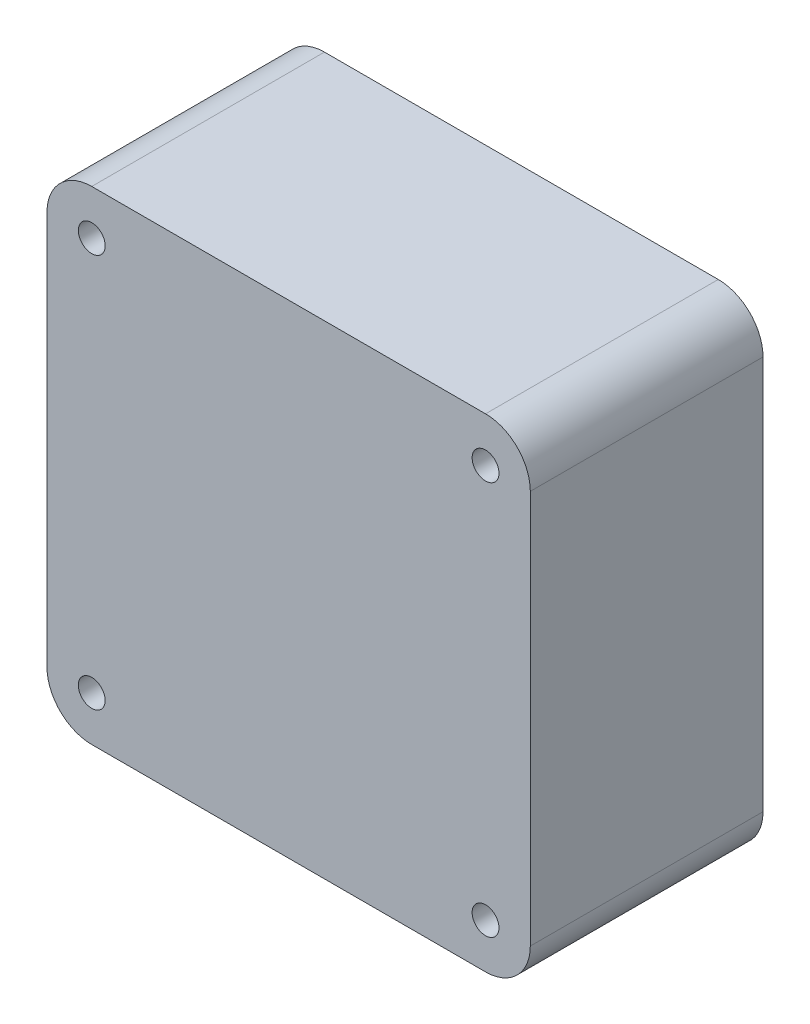
from build123d import *

# Parameters (mm, degrees)
CROQUIS1_W              = 54
CROQUIS1_H              = 54
SALIENTE_EXTRUIR1_DEPTH = 26
REDONDEO1_R             = 5
CROQUIS2_R              = 1.5
CORTAR_EXTRUIR1_DEPTH   = 47.19523785


with BuildPart() as part:
    # Croquis1 → Saliente-Extruir1 (new body)
    with BuildSketch(Plane.XY):
        Rectangle(CROQUIS1_W, CROQUIS1_H)
    extrude(amount=SALIENTE_EXTRUIR1_DEPTH)

    # Redondeo1
    redondeo1_edges = [part.edges().sort_by_distance(p)[0] for p in [
        (-27, 27, 13),
        (27, 27, 13),
        (27, -27, 13),
        (-27, -27, 13),
    ]]
    fillet(redondeo1_edges, radius=REDONDEO1_R)

    # Croquis2 → Cortar-Extruir1 (cut, through all)
    with BuildSketch(Plane.XY.offset(26)):
        with Locations((-22, 22)):
            Circle(CROQUIS2_R)
        with Locations((22, 22)):
            Circle(CROQUIS2_R)
        with Locations((22, -22)):
            Circle(CROQUIS2_R)
        with Locations((-22, -22)):
            Circle(CROQUIS2_R)
    extrude(amount=-CORTAR_EXTRUIR1_DEPTH, mode=Mode.SUBTRACT)


solid = part.part
